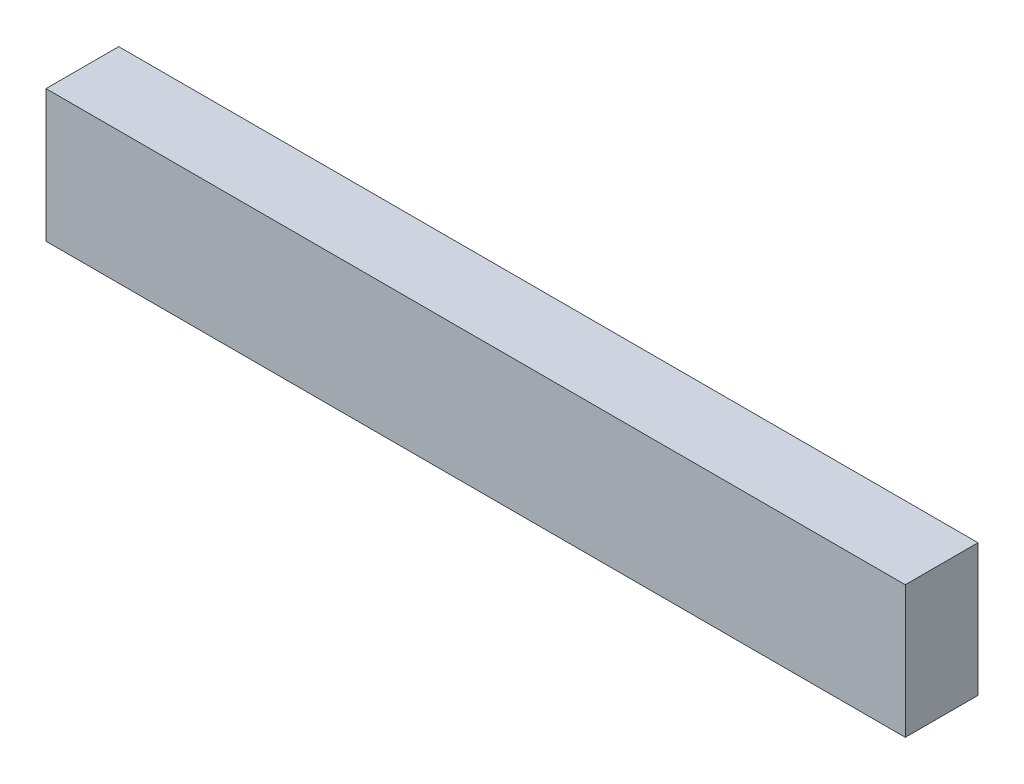
from build123d import *

# Parameters (mm, degrees)
SKETCH1_W           = 279.4
SKETCH1_H           = 508
BOSS_EXTRUDE1_DEPTH = 3302


with BuildPart() as part:
    # Sketch1 → Boss-Extrude1 (new body)
    with BuildSketch(Plane(origin=(0, 0, 0), x_dir=(0, 0, -1), z_dir=(1, 0, 0))):
        with Locations((139.7, 254)):
            Rectangle(SKETCH1_W, SKETCH1_H)
    extrude(amount=BOSS_EXTRUDE1_DEPTH)


solid = part.part
